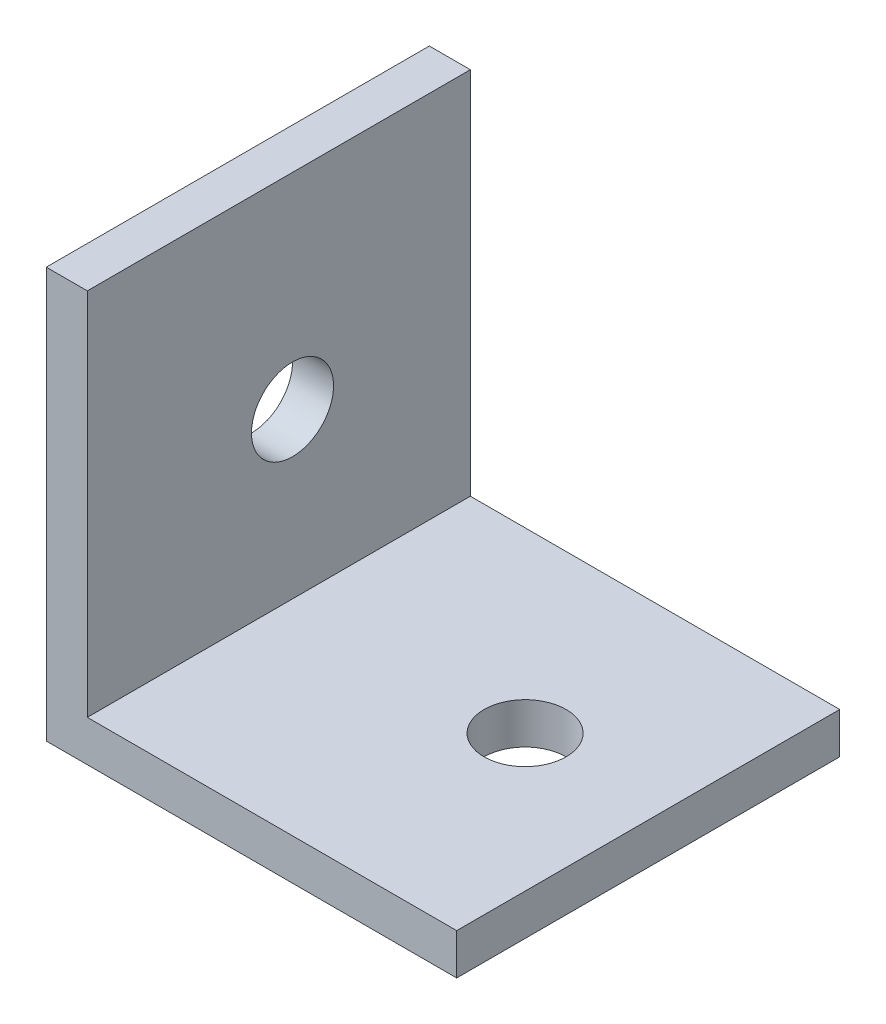
from build123d import *

# Parameters (mm, degrees)
EXTRUSION1_DEPTH = 14
ESQUISSE2_R      = 1.5
EXTRUSION2_DEPTH = 14
ESQUISSE3_R      = 1.5
EXTRUSION3_DEPTH = 14


with BuildPart() as part:
    # Esquisse1 → Extrusion1 (new body)
    with BuildSketch(Plane.XY):
        Polygon((-18.044406835, 3.872316684), (-18.044406835, -11.127683316), (-3.044406835, -11.127683316), (-3.044406835, -9.627683316), (-16.544406835, -9.627683316), (-16.544406835, 3.872316684), align=None)
    extrude(amount=EXTRUSION1_DEPTH)

    # Esquisse2 → Extrusion2 (cut)
    with BuildSketch(Plane(origin=(0, -9.627683316, 0), x_dir=(-1, 0, 0), z_dir=(0, 1, 0))):
        with Locations((8.044406835, 6.5)):
            Circle(ESQUISSE2_R)
    extrude(amount=-EXTRUSION2_DEPTH, mode=Mode.SUBTRACT)

    # Esquisse3 → Extrusion3 (cut)
    with BuildSketch(Plane.ZY.offset(18.044406835)):
        with Locations((6.5, -3.627683316)):
            Circle(ESQUISSE3_R)
    extrude(amount=-EXTRUSION3_DEPTH, mode=Mode.SUBTRACT)


solid = part.part
